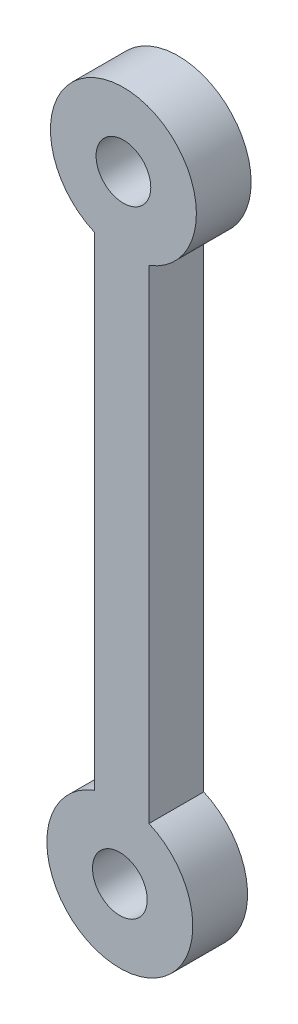
from build123d import *

# Parameters (mm, degrees)
SKETCH1_R           = 1.5
BOSS_EXTRUDE1_DEPTH = 3


with BuildPart() as part:
    # Sketch1 → Boss-Extrude1 (new body)
    with BuildSketch(Plane.XY):
        with BuildLine():
            Line((0, 0), (0, 26.5))
            ThreePointArc((0, 26.5), (1.703267099, 34.165636698), (3, 26.420858549))
            Line((3, 26.420858549), (3, -0.079141451))
            ThreePointArc((3, -0.079141451), (1.296732901, -7.744778149), (0, 0))
        make_face()
        with Locations((1.597781863, 30.167027832)):
            Circle(SKETCH1_R, mode=Mode.SUBTRACT)
        with Locations((1.402218137, -3.746169283)):
            Circle(SKETCH1_R, mode=Mode.SUBTRACT)
    extrude(amount=BOSS_EXTRUDE1_DEPTH)


solid = part.part
